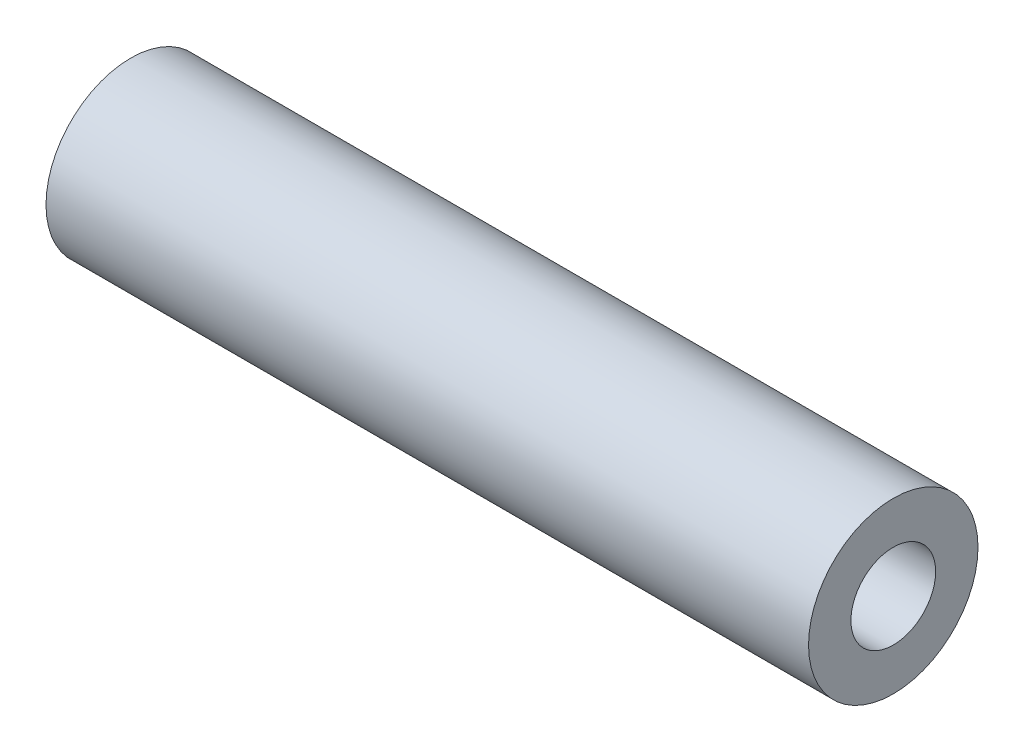
from build123d import *

# Parameters (mm, degrees)
SKETCH1_R                  = 6.35
SKETCH1_R_2                = 3.175
ALUMINA_TUBE_EXTRUDE_DEPTH = 57.15


with BuildPart() as part:
    # Sketch1 → Alumina Tube Extrude (new body)
    with BuildSketch(Plane(origin=(0, 0, 0), x_dir=(0, 0, -1), z_dir=(1, 0, 0))):
        Circle(SKETCH1_R)
        Circle(SKETCH1_R_2, mode=Mode.SUBTRACT)
    extrude(amount=ALUMINA_TUBE_EXTRUDE_DEPTH)


solid = part.part
